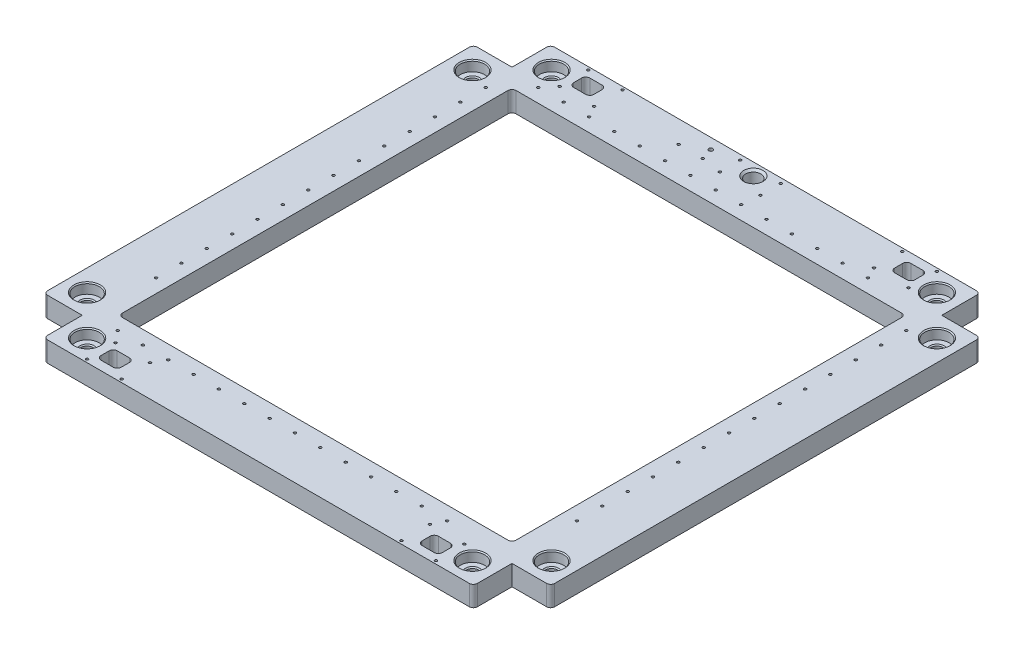
from build123d import *

# Parameters (mm, degrees)
SKETCH1_W                      = 500
SKETCH1_H                      = 500
BOSS_EXTRUDE1_DEPTH            = 20
BEARING_PRESS_FIT_D            = 12
CIRPATTERN1_COUNT              = 4
SKETCH5_W                      = 388
SKETCH5_H                      = 388
CUT_EXTRUDE1_DEPTH             = 20
SKETCH10_W                     = 428
SKETCH10_H                     = 428
SKETCH10_W_2                   = 403
SKETCH10_H_2                   = 403
LINEAR_RAIL_SLOT_DEPTH         = 2.5
FILLET2_R                      = 4
TAP_DRILL_FOR_M3X0_5_TAP1_D    = 2.5
MIRROR6_COPY_1_D               = 2.5
BOSS_EXTRUDE2_DEPTH            = 2.5
CIRPATTERN4_COUNT              = 4
CUT_EXTRUDE3_DEPTH             = 355.118624193
TAP_DRILL_FOR_M3X0_5_TAP6_D    = 2.5
MIRROR9_COPY_1_DEPTH           = 355.118624193
MIRROR9_COPY_2_D               = 2.5
SKETCH27_W                     = 38.1
SKETCH27_H                     = 38.1
CUT_EXTRUDE4_DEPTH             = 20
CIRPATTERN3_COUNT              = 4
FILLET5_R                      = 4
TAP_DRILL_FOR_M3X0_5_TAP4_D    = 2.5
F_15_0_15_DIAMETER_HOLE2_D     = 15
CHAMFER1_SIZE                  = 2
F_24_0_24_DIAMETER_HOLE1_D     = 24
F_24_0_24_DIAMETER_HOLE1_DEPTH = 10
CHAMFER2_SIZE                  = 1
FILLET6_R                      = 4
TAP_DRILL_FOR_M3X0_5_TAP7_D    = 2.5
F_4_0_4_DIAMETER_HOLE1_D       = 4


with BuildPart() as part:
    # Sketch1 → Boss-Extrude1 (new body)
    with BuildSketch(Plane(origin=(0, 0, 0), x_dir=(1, 0, 0), z_dir=(0, 1, 0))):
        Rectangle(SKETCH1_W, SKETCH1_H)
    extrude(amount=BOSS_EXTRUDE1_DEPTH)

    # Bearing Press Fit (through all)
    with Locations(Plane(origin=(0, 20, 0), x_dir=(1, 0, 0), z_dir=(0, 1, 0))):
        with Locations((-190, 229), (-229, 190)):
            bearing_press_fit = Hole(BEARING_PRESS_FIT_D / 2)

    # CirPattern1: Bearing Press Fit ×4 about axis
    cirpattern1_axis = Axis((0, 0, 0), (0, 1, 0))
    for i in range(1, CIRPATTERN1_COUNT):
        add(bearing_press_fit.rotate(cirpattern1_axis, i * 360 / CIRPATTERN1_COUNT), mode=Mode.SUBTRACT)

    # Sketch5 → Cut-Extrude1 (cut)
    with BuildSketch(Plane(origin=(0, 20, 0), x_dir=(1, 0, 0), z_dir=(0, 1, 0))):
        Rectangle(SKETCH5_W, SKETCH5_H)
    extrude(amount=-CUT_EXTRUDE1_DEPTH, mode=Mode.SUBTRACT)

    # Sketch10 → Linear Rail Slot (cut)
    with BuildSketch(Plane(origin=(0, 0, 0), x_dir=(1, 0, 0), z_dir=(0, 1, 0))):
        Rectangle(SKETCH10_W, SKETCH10_H)
        Rectangle(SKETCH10_W_2, SKETCH10_H_2, mode=Mode.SUBTRACT)
    extrude(amount=LINEAR_RAIL_SLOT_DEPTH, mode=Mode.SUBTRACT)

    # Fillet2
    fillet2_edges = [part.edges().sort_by_distance(p)[0] for p in [
        (-194, 10, 194),
        (-194, 10, -194),
        (194, 10, -194),
        (194, 10, 194),
    ]]
    fillet(fillet2_edges, radius=FILLET2_R)

    # Tap Drill for M3x0.5 Tap1 (through all)
    with Locations(Plane(origin=(0, 2.5, 0), x_dir=(-1, 0, 0), z_dir=(0, -1, 0))):
        with Locations((-143.5, -207.5), (-118.5, -207.5), (-93.5, -207.5), (-68.5, -207.5), (-43.5, -207.5), (-18.5, -207.5), (6.5, -207.5), (31.5, -207.5), (56.5, -207.5), (81.5, -207.5), (106.5, -207.5), (131.5, -207.5), (156.5, -207.5), (181.5, -207.5)):
            tap_drill_for_m3x0_5_tap1 = Hole(TAP_DRILL_FOR_M3X0_5_TAP1_D / 2)

    # Mirror5: Tap Drill for M3x0.5 Tap1 across plane
    add(tap_drill_for_m3x0_5_tap1.mirror(Plane.XY), mode=Mode.SUBTRACT)

    # Mirror6: Tap Drill for M3x0.5 Tap1 across plane
    add(tap_drill_for_m3x0_5_tap1.mirror(Plane(origin=(0, 0, 0), x_dir=(0.7071067811865478, 0, 0.7071067811865472), z_dir=(-0.7071067811865475, 0, 0.7071067811865477))), mode=Mode.SUBTRACT)

    # Mirror6 copy 1 (through all)
    with Locations(Plane(origin=(0, 2.5, 0), x_dir=(0, 0, -1), z_dir=(0, -1, 0))):
        with Locations((-143.5, -207.5), (-118.5, -207.5), (-93.5, -207.5), (-68.5, -207.5), (-43.5, -207.5), (-18.5, -207.5), (6.5, -207.5), (31.5, -207.5), (56.5, -207.5), (81.5, -207.5), (106.5, -207.5), (131.5, -207.5), (156.5, -207.5), (181.5, -207.5)):
            Hole(MIRROR6_COPY_1_D / 2)

    # Sketch19 → Boss-Extrude2 (add)
    with BuildSketch(Plane.XZ.offset(-2.5)):
        Polygon((-198.5, 201.5), (-198.5, 214), (-214, 214), (-214, 198.5), (-201.5, 198.5), (-201.5, 201.5), align=None)
    boss_extrude2 = extrude(amount=BOSS_EXTRUDE2_DEPTH)

    # CirPattern4: Boss-Extrude2 ×4 about axis
    cirpattern4_axis = Axis((0, 0, 0), (0, 1, 0))
    for i in range(1, CIRPATTERN4_COUNT):
        add(boss_extrude2.rotate(cirpattern4_axis, i * 360 / CIRPATTERN4_COUNT))

    # Sketch20 → Cut-Extrude3 (cut, through all)
    with BuildSketch(Plane(origin=(0, 20, 0), x_dir=(1, 0, 0), z_dir=(0, 1, 0))):
        with BuildLine():
            Line((164.3, -241), (152.3, -241))
            ThreePointArc((152.3, -241), (149.471572875, -239.828427125), (148.3, -237))
            Line((148.3, -237), (148.3, -229))
            ThreePointArc((148.3, -229), (149.471572875, -226.171572875), (152.3, -225))
            Line((152.3, -225), (164.3, -225))
            ThreePointArc((164.3, -225), (167.128427125, -226.171572875), (168.3, -229))
            Line((168.3, -229), (168.3, -237))
            ThreePointArc((168.3, -237), (167.128427125, -239.828427125), (164.3, -241))
        make_face()
    cut_extrude3 = extrude(amount=-CUT_EXTRUDE3_DEPTH, mode=Mode.SUBTRACT)

    # Tap Drill for M3x0.5 Tap6 (through all)
    with Locations(Plane(origin=(0, 20, 0), x_dir=(1, 0, 0), z_dir=(0, 1, 0))):
        with Locations((172, -247), (138, -219), (172, -219), (138, -247)):
            tap_drill_for_m3x0_5_tap6 = Hole(TAP_DRILL_FOR_M3X0_5_TAP6_D / 2)

    # Mirror8: Cut-Extrude3, Tap Drill for M3x0.5 Tap6 across plane
    add(cut_extrude3.mirror(Plane(origin=(0, 0, 0), x_dir=(0, 0, 1), z_dir=(1, 0, 0))), mode=Mode.SUBTRACT)
    add(tap_drill_for_m3x0_5_tap6.mirror(Plane(origin=(0, 0, 0), x_dir=(0, 0, 1), z_dir=(1, 0, 0))), mode=Mode.SUBTRACT)

    # Mirror9: Cut-Extrude3, Tap Drill for M3x0.5 Tap6 across plane
    add(cut_extrude3.mirror(Plane.XY), mode=Mode.SUBTRACT)
    add(tap_drill_for_m3x0_5_tap6.mirror(Plane.XY), mode=Mode.SUBTRACT)

    # Mirror9 copy 1 sketch → Mirror9 copy 1 (cut, through all)
    with BuildSketch(Plane(origin=(0, 20, 0), x_dir=(-1, 0, 0), z_dir=(0, 1, 0))):
        with BuildLine():
            Line((164.3, -241), (152.3, -241))
            ThreePointArc((152.3, -241), (149.471572875, -239.828427125), (148.3, -237))
            Line((148.3, -237), (148.3, -229))
            ThreePointArc((148.3, -229), (149.471572875, -226.171572875), (152.3, -225))
            Line((152.3, -225), (164.3, -225))
            ThreePointArc((164.3, -225), (167.128427125, -226.171572875), (168.3, -229))
            Line((168.3, -229), (168.3, -237))
            ThreePointArc((168.3, -237), (167.128427125, -239.828427125), (164.3, -241))
        make_face()
    extrude(amount=-MIRROR9_COPY_1_DEPTH, mode=Mode.SUBTRACT)

    # Mirror9 copy 2 (through all)
    with Locations(Plane(origin=(0, 20, 0), x_dir=(-1, 0, 0), z_dir=(0, 1, 0))):
        with Locations((172, -247), (138, -219), (172, -219), (138, -247)):
            Hole(MIRROR9_COPY_2_D / 2)

    # Sketch27 → Cut-Extrude4 (cut)
    with BuildSketch(Plane(origin=(0, 20, 0), x_dir=(1, 0, 0), z_dir=(0, 1, 0))):
        with Locations((230.95, -230.95)):
            Rectangle(SKETCH27_W, SKETCH27_H)
    cut_extrude4 = extrude(amount=-CUT_EXTRUDE4_DEPTH, mode=Mode.SUBTRACT)

    # CirPattern3: Cut-Extrude4 ×4 about axis
    cirpattern3_axis = Axis((0, 0, 0), (0, 1, 0))
    for i in range(1, CIRPATTERN3_COUNT):
        add(cut_extrude4.rotate(cirpattern3_axis, i * 360 / CIRPATTERN3_COUNT), mode=Mode.SUBTRACT)

    # Fillet5
    fillet5_edges = [part.edges().sort_by_distance(p)[0] for p in [
        (-201.5, 1.25, 198.5),
        (-214, 1.25, 198.5),
        (-198.5, 1.25, 214),
        (-198.5, 1.25, 201.5),
        (-198.5, 1.25, -201.5),
        (-198.5, 1.25, -214),
        (-214, 1.25, -198.5),
        (-201.5, 1.25, -198.5),
        (201.5, 1.25, -198.5),
        (214, 1.25, -198.5),
        (198.5, 1.25, -214),
        (198.5, 1.25, -201.5),
        (198.5, 1.25, 201.5),
        (198.5, 1.25, 214),
        (214, 1.25, 198.5),
        (201.5, 1.25, 198.5),
    ]]
    fillet(fillet5_edges, radius=FILLET5_R)

    # Tap Drill for M3x0.5 Tap4 (through all)
    with Locations(Plane(origin=(0, 20, 0), x_dir=(1, 0, 0), z_dir=(0, 1, 0))):
        with Locations((-20, 245), (20, 225), (20, 245), (-20, 225), (0, 235)):
            Hole(TAP_DRILL_FOR_M3X0_5_TAP4_D / 2)

    # Ø15.0 (15) Diameter Hole2 (through all)
    with Locations(Plane(origin=(0, 20, 0), x_dir=(1, 0, 0), z_dir=(0, 1, 0))):
        with Locations((0, 238)):
            Hole(F_15_0_15_DIAMETER_HOLE2_D / 2)

    # Chamfer1
    chamfer1_edges = [part.edges().sort_by_distance(p)[0] for p in [
        (7.5, 20, -238),
        (7.5, 0, -238),
    ]]
    chamfer(chamfer1_edges, length=CHAMFER1_SIZE)

    # Ø24.0 (24) Diameter Hole1
    with Locations(Plane(origin=(0, 20, 0), x_dir=(1, 0, 0), z_dir=(0, 1, 0))):
        with Locations((-229, -190), (-190, -229), (190, -229), (229, -190), (229, 190), (190, 229), (-190, 229), (-229, 190)):
            Hole(F_24_0_24_DIAMETER_HOLE1_D / 2, depth=F_24_0_24_DIAMETER_HOLE1_DEPTH)

    # Chamfer2
    chamfer2_edges = [part.edges().sort_by_distance(p)[0] for p in [
        (-223, 10, -190),
        (-217, 20, -190),
        (-184, 10, -229),
        (-178, 20, -229),
        (190, 10, -223),
        (202, 20, -229),
        (229, 10, -184),
        (241, 20, -190),
        (223, 10, 190),
        (241, 20, 190),
        (184, 10, 229),
        (202, 20, 229),
        (-190, 10, 223),
        (-178, 20, 229),
        (-229, 10, 184),
        (-217, 20, 190),
        (-223, 0, -190),
        (-184, 0, -229),
        (190, 0, -223),
        (229, 0, -184),
        (223, 0, 190),
        (184, 0, 229),
        (-190, 0, 223),
        (-229, 0, 184),
    ]]
    chamfer(chamfer2_edges, length=CHAMFER2_SIZE)

    # Fillet6
    fillet6_edges = [part.edges().sort_by_distance(p)[0] for p in [
        (250, 10, 211.9),
        (211.9, 10, 250),
        (-211.9, 10, 250),
        (-250, 10, 211.9),
        (-250, 10, -211.9),
        (-211.9, 10, -250),
        (211.9, 10, -250),
        (250, 10, -211.9),
    ]]
    fillet(fillet6_edges, radius=FILLET6_R)

    # Tap Drill for M3x0.5 Tap7 (through all)
    with Locations(Plane(origin=(0, 20, 0), x_dir=(1, 0, 0), z_dir=(0, 1, 0))):
        with Locations((-63.773719933, 228), (-39.773719933, 228)):
            Hole(TAP_DRILL_FOR_M3X0_5_TAP7_D / 2)

    # Ø4.0 (4) Diameter Hole1 (through all)
    with Locations(Plane(origin=(0, 20, 0), x_dir=(1, 0, 0), z_dir=(0, 1, 0))):
        with Locations((-43.473719933, 239.5)):
            Hole(F_4_0_4_DIAMETER_HOLE1_D / 2)


solid = part.part
